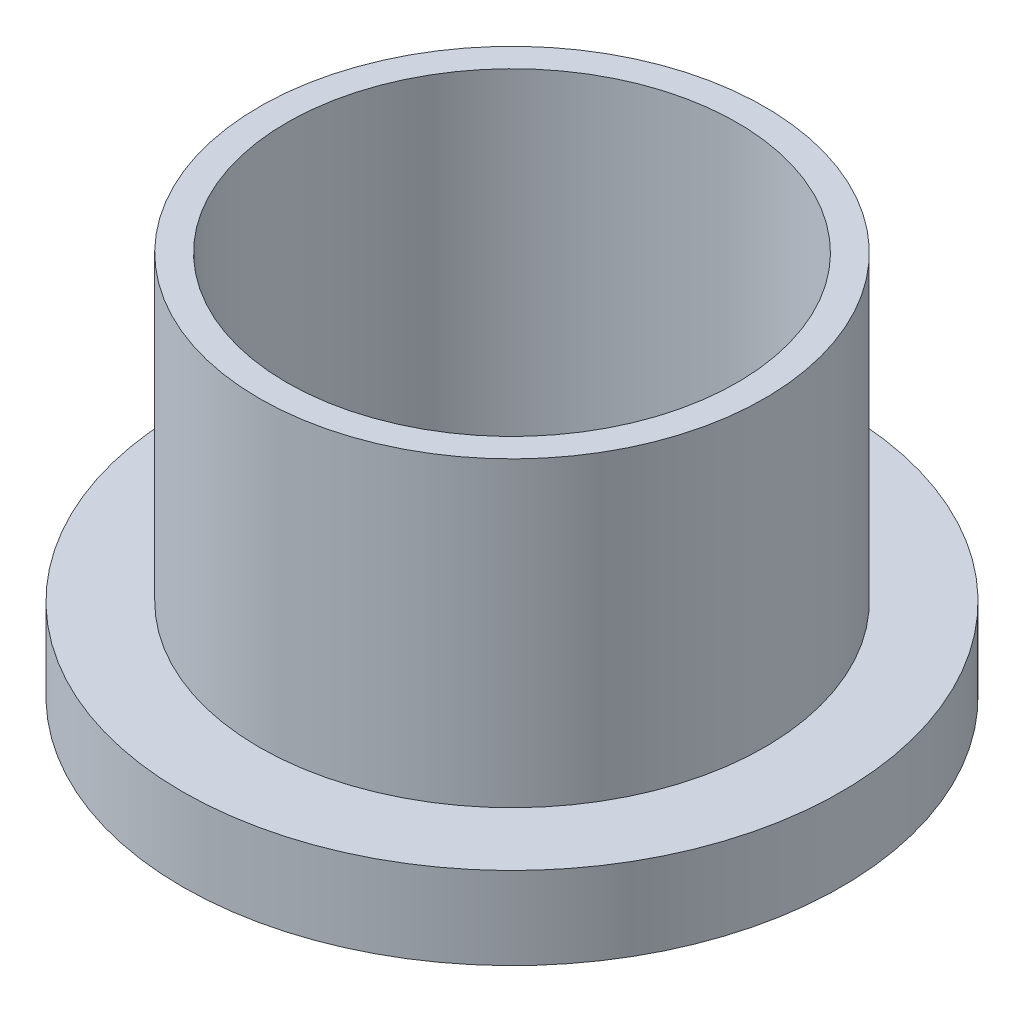
from build123d import *

# Parameters (mm, degrees)
BASES_R      = 4.6
BASES_R_2    = 4.1
BASE_DEPTH   = 7
FLANGES_R    = 6
FLANGES_R_2  = 4.6
FLANGE_DEPTH = 1.5


with BuildPart() as part:
    # BaseS → BASE (new body)
    with BuildSketch(Plane(origin=(0, 0, 0), x_dir=(1, 0, 0), z_dir=(0, 1, 0))):
        with Locations(Location((0, 0, 0), (0, 0, 270))):
            Circle(BASES_R)
        with Locations(Location((0, 0, 0), (0, 0, 270))):
            Circle(BASES_R_2, mode=Mode.SUBTRACT)
    extrude(amount=BASE_DEPTH)

    # FlangeS → FLANGE (add)
    with BuildSketch(Plane(origin=(0, 0, 0), x_dir=(1, 0, 0), z_dir=(0, 1, 0))):
        with Locations(Location((0, 0, 0), (0, 0, 270))):
            Circle(FLANGES_R)
        with Locations(Location((0, 0, 0), (0, 0, 270))):
            Circle(FLANGES_R_2, mode=Mode.SUBTRACT)
    extrude(amount=FLANGE_DEPTH)


solid = part.part
